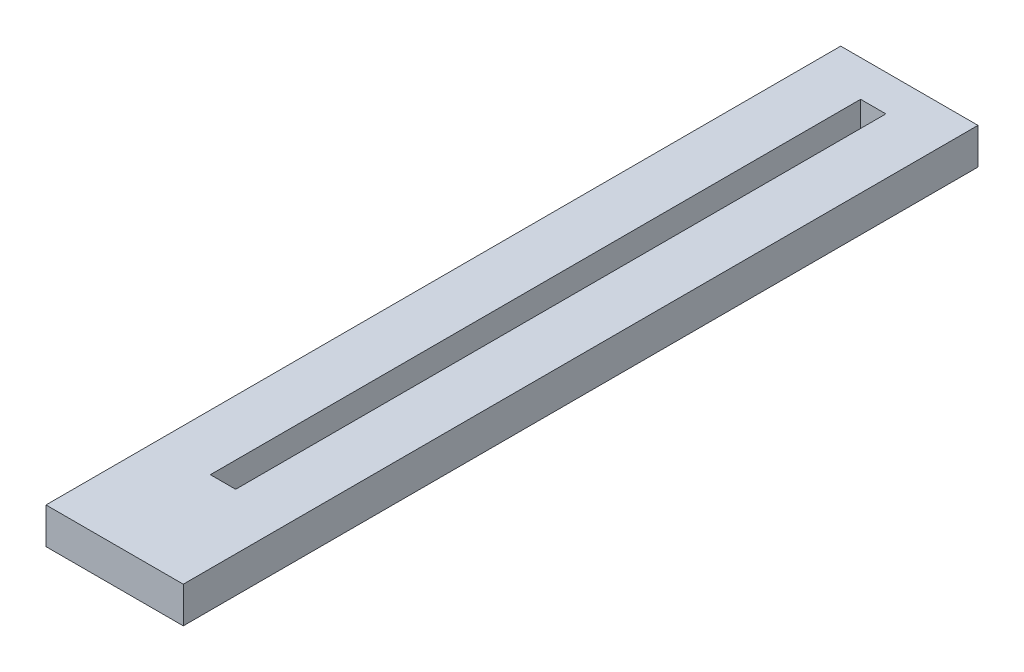
from build123d import *

# Parameters (mm, degrees)
SKETCH1_W           = 19
SKETCH1_H           = 110
SKETCH1_W_2         = 3.5
SKETCH1_H_2         = 90
BOSS_EXTRUDE1_DEPTH = 5


with BuildPart() as part:
    # Sketch1 → Boss-Extrude1 (new body)
    with BuildSketch(Plane(origin=(0, 0, 0), x_dir=(1, 0, 0), z_dir=(0, 1, 0))):
        with Locations((-9.5, 55)):
            Rectangle(SKETCH1_W, SKETCH1_H)
        with Locations((-9.5, 60)):
            Rectangle(SKETCH1_W_2, SKETCH1_H_2, mode=Mode.SUBTRACT)
    extrude(amount=BOSS_EXTRUDE1_DEPTH)


solid = part.part
